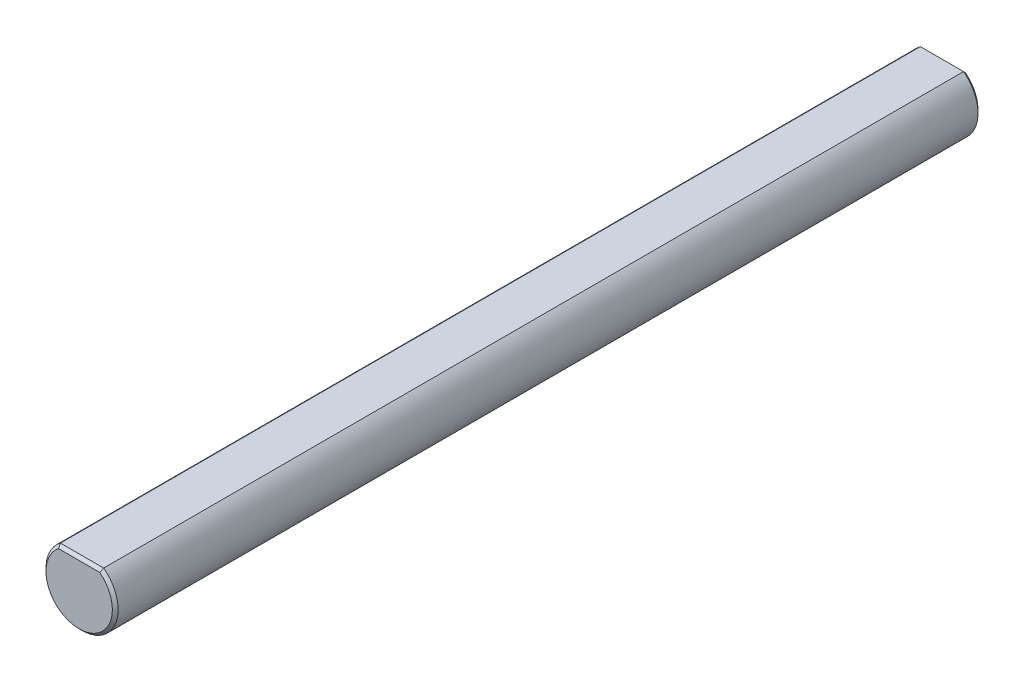
from build123d import *

# Parameters (mm, degrees)
BOSS_EXTRUDE1_DEPTH = 38.1
CHAMFER1_SIZE       = 0.254


with BuildPart() as part:
    # Sketch1 → Boss-Extrude1 (new, symmetric)
    with BuildSketch(Plane.XY):
        with BuildLine():
            Line((1.905, 2.54), (-1.905, 2.54))
            ThreePointArc((-1.905, 2.54), (0, -3.175), (1.905, 2.54))
        make_face()
    extrude(amount=BOSS_EXTRUDE1_DEPTH, both=True)

    # Chamfer1
    chamfer1_edges = [part.edges().sort_by_distance(p)[0] for p in [
        (0, 2.54, -38.1),
        (0, -3.175, -38.1),
        (0, -3.175, 38.1),
        (0, 2.54, 38.1),
    ]]
    chamfer(chamfer1_edges, length=CHAMFER1_SIZE)


solid = part.part
